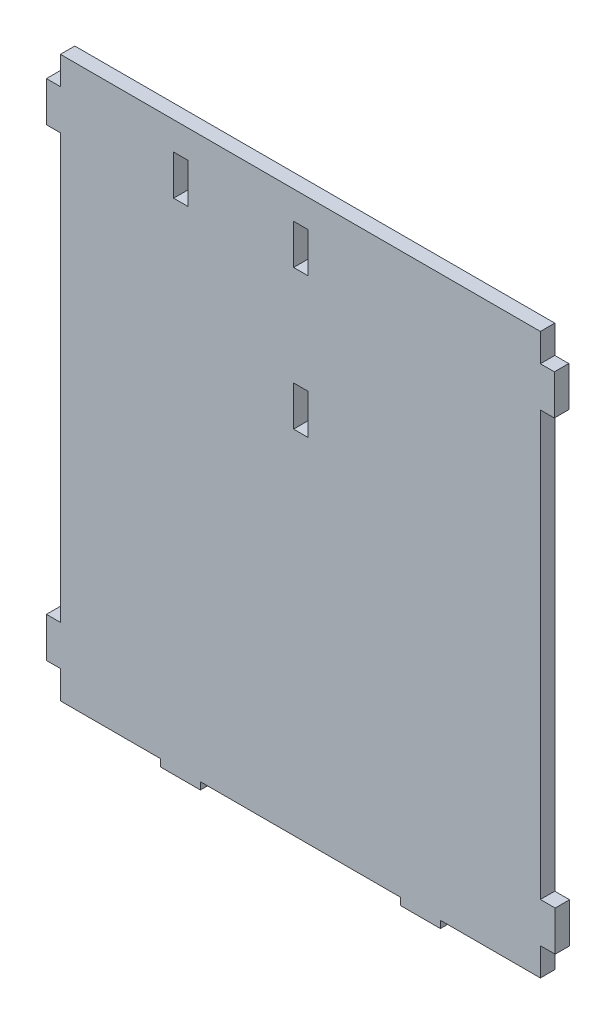
from build123d import *

# Parameters (mm, degrees)
SKETCH1_W           = 18
SKETCH1_H           = 50
BOSS_EXTRUDE1_DEPTH = 18


with BuildPart() as part:
    # Sketch1 → Boss-Extrude1 (new body)
    with BuildSketch(Plane.XY):
        Polygon((-300.514492677, 322.5), (299.485507323, 322.5), (299.485507323, 287.5), (316.971014646, 287.5), (316.971014646, 237.5), (299.485507323, 237.5), (299.485507323, -292.5), (318, -292.5), (318, -342.5), (299.485507323, -342.5), (299.485507323, -377.5), (174.485507323, -377.5), (174.485507323, -386.5), (124.485507323, -386.5), (124.485507323, -377.5), (-125.514492677, -377.5), (-125.514492677, -386.5), (-175.514492677, -386.5), (-175.514492677, -377.5), (-300.514492677, -377.5), (-300.514492677, -342.5), (-318, -342.5), (-318, -292.5), (-300.514492677, -292.5), (-300.514492677, 237.5), (-318, 237.5), (-318, 287.5), (-300.514492677, 287.5), align=None)
        with Locations((-150, 262.5)):
            Rectangle(SKETCH1_W, SKETCH1_H, mode=Mode.SUBTRACT)
        with Locations((0, 262.5)):
            Rectangle(SKETCH1_W, SKETCH1_H, mode=Mode.SUBTRACT)
        with Locations((0, 87.5)):
            Rectangle(SKETCH1_W, SKETCH1_H, mode=Mode.SUBTRACT)
    extrude(amount=BOSS_EXTRUDE1_DEPTH)


solid = part.part
